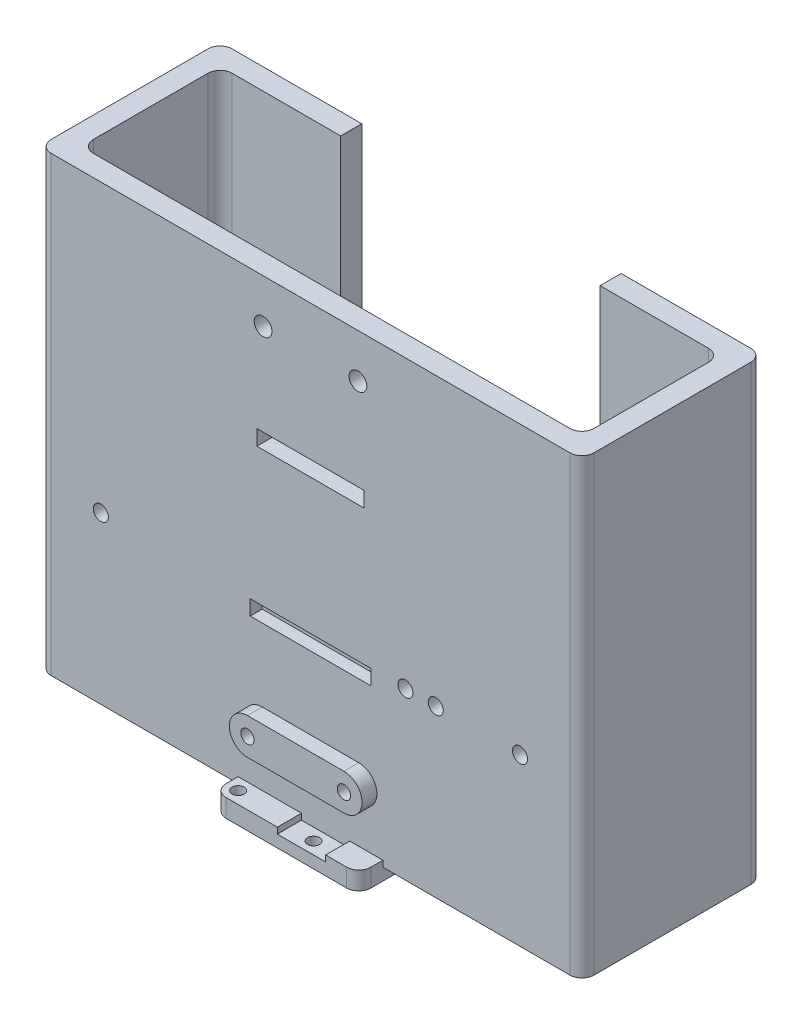
from build123d import *

# Parameters (mm, degrees)
BOSS_EXTRUDE1_DEPTH      = 75
SKETCH2_R                = 1.1
CUT_EXTRUDE1_DEPTH       = 121.933866224
BOSS_EXTRUDE2_DEPTH      = 2.458497378
SKETCH4_R                = 1.1
CUT_EXTRUDE2_DEPTH       = 121.933866224
SKETCH5_W                = 20
SKETCH5_H                = 2.5
CUT_EXTRUDE3_DEPTH       = 2
CUT_EXTRUDE4_DEPTH       = 121.933866224
CUT_EXTRUDE4_DEPTH_BACK  = 2.55
SKETCH6_W                = 17.78
SKETCH6_H                = 2.54
SKETCH7_W                = 1
SKETCH7_H                = 0.979795898
CUT_EXTRUDE5_DEPTH       = 121.113488002
SKETCH8_W                = 0.635
SKETCH8_H                = 0.635
CUT_EXTRUDE6_DEPTH       = 121.113488002
BOSS_EXTRUDE3_DEPTH      = 2
BOSS_EXTRUDE3_DEPTH_BACK = 1
SKETCH9_W                = 24
SKETCH9_H                = 25
FILLET1_R                = 2
SKETCH10_R               = 1
CUT_EXTRUDE7_DEPTH       = 4
SKETCH11_W               = 8
SKETCH11_H               = 4
CUT_EXTRUDE8_DEPTH       = 1
FILLET2_R                = 2
SKETCH12_R               = 1.25
SKETCH12_R_2             = 1.47
CUT_EXTRUDE10_DEPTH      = 3.5


with BuildPart() as part:
    # Sketch1 → Boss-Extrude1 (new body)
    with BuildSketch(Plane(origin=(0, 0, 0), x_dir=(1, 0, 0), z_dir=(0, 1, 0))):
        Polygon((23.5, 30), (23.5, 26.5), (3.5, 26.5), (3.5, 3.5), (86.5, 3.5), (86.5, 26.5), (66.5, 26.5), (66.5, 30), (90, 30), (90, 0), (0, 0), (0, 30), align=None)
    extrude(amount=BOSS_EXTRUDE1_DEPTH)

    # Sketch2 → Cut-Extrude1 (cut, through all)
    with BuildSketch(Plane.XY):
        with Locations((53, 10)):
            Circle(SKETCH2_R)
        with Locations((37, 10)):
            Circle(SKETCH2_R)
    extrude(amount=-CUT_EXTRUDE1_DEPTH, mode=Mode.SUBTRACT)

    # Sketch3 → Boss-Extrude2 (add)
    with BuildSketch(Plane.XY):
        with BuildLine():
            Line((53, 13), (37, 13))
            ThreePointArc((37, 13), (34, 10), (37, 7))
            Line((37, 7), (53, 7))
            ThreePointArc((53, 7), (56, 10), (53, 13))
        make_face()
    extrude(amount=BOSS_EXTRUDE2_DEPTH)

    # Sketch4 → Cut-Extrude2 (cut, through all)
    with BuildSketch(Plane(origin=(0, 0, 0), x_dir=(-1, 0, 0), z_dir=(0, 0, -1))):
        with Locations(Location((-37, 10, 0), (0, 0, 180))):
            Circle(SKETCH4_R)
        with Locations(Location((-53, 10, 0), (0, 0, 180))):
            Circle(SKETCH4_R)
    extrude(amount=-CUT_EXTRUDE2_DEPTH, mode=Mode.SUBTRACT)

    # Sketch5 → Cut-Extrude3 (cut)
    with BuildSketch(Plane.XY):
        with Locations((44.985, 26.3)):
            Rectangle(SKETCH5_W, SKETCH5_H)
    extrude(amount=-CUT_EXTRUDE3_DEPTH, mode=Mode.SUBTRACT)

    # Sketch6 → Cut-Extrude4 (cut, two sides: drawn at the far end of the back side and taken through both)
    with BuildSketch(Plane.XY.offset(-CUT_EXTRUDE4_DEPTH_BACK)):
        with Locations((44.99, 51.27)):
            Rectangle(SKETCH6_W, SKETCH6_H)
    extrude(amount=CUT_EXTRUDE4_DEPTH + CUT_EXTRUDE4_DEPTH_BACK, mode=Mode.SUBTRACT)

    # Sketch7 → Cut-Extrude5 (cut, through all)
    with BuildSketch(Plane(origin=(0, 0, -3.5), x_dir=(-1, 0, 0), z_dir=(0, 0, -1))):
        with Locations((-53.765, 26.2)):
            Rectangle(SKETCH7_W, SKETCH7_H)
        with Locations((-51.245, 26.2)):
            Rectangle(SKETCH7_W, SKETCH7_H)
        with Locations((-48.735, 26.2)):
            Rectangle(SKETCH7_W, SKETCH7_H)
        with Locations((-46.215, 26.2)):
            Rectangle(SKETCH7_W, SKETCH7_H)
        with Locations((-43.705, 26.2)):
            Rectangle(SKETCH7_W, SKETCH7_H)
        with Locations((-41.195, 26.2)):
            Rectangle(SKETCH7_W, SKETCH7_H)
        with Locations((-38.685, 26.2)):
            Rectangle(SKETCH7_W, SKETCH7_H)
        with Locations((-36.175, 26.2)):
            Rectangle(SKETCH7_W, SKETCH7_H)
    extrude(amount=-CUT_EXTRUDE5_DEPTH, mode=Mode.SUBTRACT)

    # Sketch8 → Cut-Extrude6 (cut, through all)
    with BuildSketch(Plane(origin=(0, 0, -3.5), x_dir=(-1, 0, 0), z_dir=(0, 0, -1))):
        with Locations((-52.61, 51.27)):
            Rectangle(SKETCH8_W, SKETCH8_H)
        with Locations((-50.07, 51.27)):
            Rectangle(SKETCH8_W, SKETCH8_H)
        with Locations((-47.53, 51.27)):
            Rectangle(SKETCH8_W, SKETCH8_H)
        with Locations((-44.99, 51.27)):
            Rectangle(SKETCH8_W, SKETCH8_H)
        with Locations((-42.45, 51.27)):
            Rectangle(SKETCH8_W, SKETCH8_H)
        with Locations((-39.91, 51.27)):
            Rectangle(SKETCH8_W, SKETCH8_H)
        with Locations((-37.37, 51.27)):
            Rectangle(SKETCH8_W, SKETCH8_H)
    extrude(amount=-CUT_EXTRUDE6_DEPTH, mode=Mode.SUBTRACT)

    # Sketch9 → Boss-Extrude3 (add, two sides: drawn at the far end of the back side and taken through both)
    with BuildSketch(Plane.XZ.offset(-BOSS_EXTRUDE3_DEPTH_BACK)):
        with Locations((45, -8.5)):
            Rectangle(SKETCH9_W, SKETCH9_H)
    extrude(amount=BOSS_EXTRUDE3_DEPTH + BOSS_EXTRUDE3_DEPTH_BACK)

    # Fillet1
    fillet1_edges = [part.edges().sort_by_distance(p)[0] for p in [
        (57, -0.5, 4),
        (33, -0.5, -21),
        (57, -0.5, -21),
        (33, -0.5, 4),
    ]]
    fillet(fillet1_edges, radius=FILLET1_R)

    # Sketch10 → Cut-Extrude7 (cut)
    with BuildSketch(Plane.XZ.offset(2)):
        with Locations((47.5, -19)):
            Circle(SKETCH10_R)
        with Locations((35, -19)):
            Circle(SKETCH10_R)
        with Locations((47.5, 2)):
            Circle(SKETCH10_R)
        with Locations((35, 2)):
            Circle(SKETCH10_R)
    extrude(amount=-CUT_EXTRUDE7_DEPTH, mode=Mode.SUBTRACT)

    # Sketch11 → Cut-Extrude8 (cut)
    with BuildSketch(Plane(origin=(0, 1, 0), x_dir=(1, 0, 0), z_dir=(0, 1, 0))):
        with Locations((47.5, -2)):
            Rectangle(SKETCH11_W, SKETCH11_H)
    extrude(amount=-CUT_EXTRUDE8_DEPTH, mode=Mode.SUBTRACT)

    # Fillet2
    fillet2_edges = [part.edges().sort_by_distance(p)[0] for p in [
        (0, 37.5, -30),
        (3.5, 37.5, -26.5),
        (3.5, 37.5, -3.5),
        (86.5, 37.5, -3.5),
        (86.5, 37.5, -26.5),
        (90, 37.5, -30),
        (90, 37.5, 0),
        (0, 37.5, 0),
    ]]
    fillet(fillet2_edges, radius=FILLET2_R)

    # Sketch12 → Cut-Extrude10 (cut)
    with BuildSketch(Plane.XY):
        with Locations((79.735, 27.5)):
            Circle(SKETCH12_R)
        with Locations((65.765, 27.5)):
            Circle(SKETCH12_R)
        with Locations((60.735, 27.5)):
            Circle(SKETCH12_R)
        with Locations((10.235, 27.5)):
            Circle(SKETCH12_R)
        with Locations((52.864, 67.714)):
            Circle(SKETCH12_R_2)
        with Locations((37.136, 67.714)):
            Circle(SKETCH12_R_2)
    extrude(amount=-CUT_EXTRUDE10_DEPTH, mode=Mode.SUBTRACT)


solid = part.part
